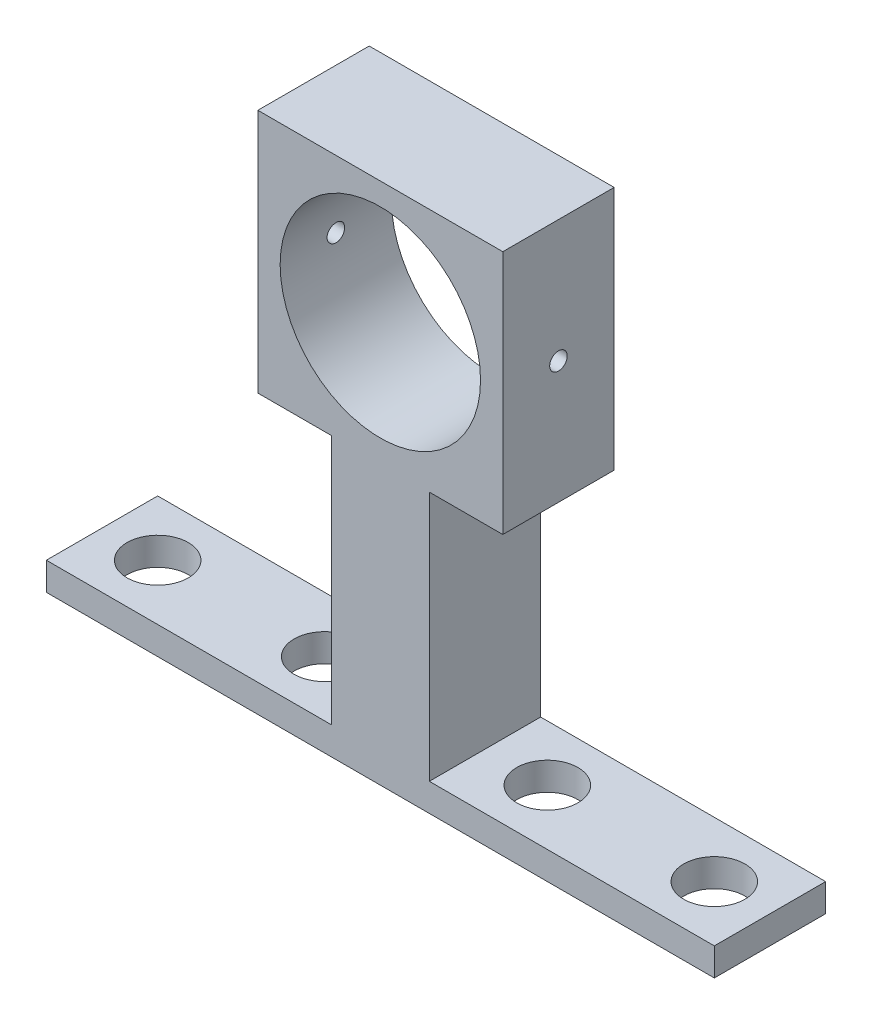
from build123d import *

# Parameters (mm, degrees)
SKETCH1_R           = 11.43
BOSS_EXTRUDE1_DEPTH = 6.35
SKETCH2_R           = 3.4925
CUT_EXTRUDE1_DEPTH  = 69.453471241
SKETCH3_R           = 1
CUT_EXTRUDE2_DEPTH  = 80.463850272


with BuildPart() as part:
    # Sketch1 → Boss-Extrude1 (new, symmetric)
    with BuildSketch(Plane.XY):
        Polygon((-38.1, 0), (38.1, 0), (38.1, 3.175), (5.588, 3.175), (5.588, 31.75), (13.97, 31.75), (13.97, 59.69), (-13.97, 59.69), (-13.97, 31.75), (-5.588, 31.75), (-5.588, 3.175), (-38.1, 3.175), align=None)
        with Locations((0, 45.72)):
            Circle(SKETCH1_R, mode=Mode.SUBTRACT)
    extrude(amount=BOSS_EXTRUDE1_DEPTH, both=True)

    # Sketch2 → Cut-Extrude1 (cut, through all)
    with BuildSketch(Plane(origin=(0, 3.175, 0), x_dir=(1, 0, 0), z_dir=(0, 1, 0))):
        with Locations(Location((-31.75, 0, 0), (0, 0, 180))):
            Circle(SKETCH2_R)
        with Locations(Location((31.75, 0, 0), (0, 0, 180))):
            Circle(SKETCH2_R)
        with Locations(Location((-12.7, 0, 0), (0, 0, 180))):
            Circle(SKETCH2_R)
        with Locations(Location((12.7, 0, 0), (0, 0, 180))):
            Circle(SKETCH2_R)
    extrude(amount=-CUT_EXTRUDE1_DEPTH, mode=Mode.SUBTRACT)

    # Sketch3 → Cut-Extrude2 (cut, through all)
    with BuildSketch(Plane(origin=(13.97, 0, 0), x_dir=(0, 0, -1), z_dir=(1, 0, 0))):
        with Locations((0, 45.72)):
            Circle(SKETCH3_R)
    extrude(amount=-CUT_EXTRUDE2_DEPTH, mode=Mode.SUBTRACT)


solid = part.part
